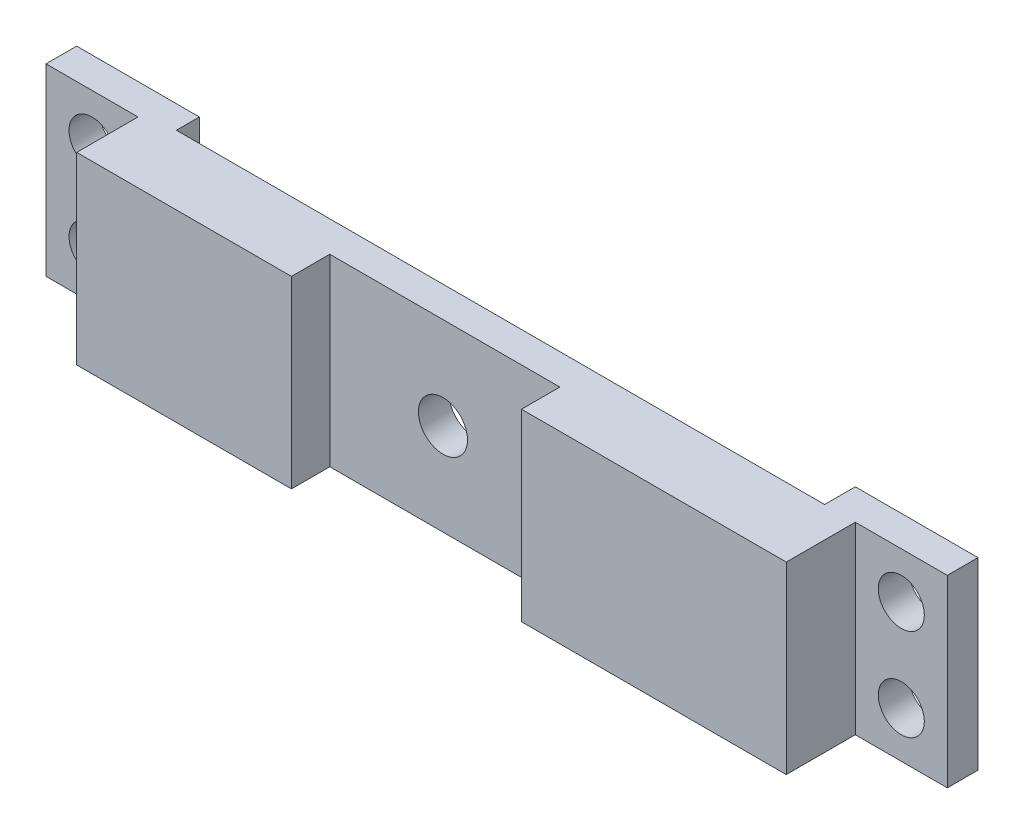
from build123d import *

# Parameters (mm, degrees)
SKETCH1_W       = 35
SKETCH1_H       = 12
EXTRUDE1_DEPTH  = 6
SKETCH2_W       = 6
SKETCH2_H       = 12
EXTRUDE2_DEPTH  = 4
SKETCH3_R       = 1.5
EXTRUDE3_DEPTH  = 2
SKETCH4_R       = 1.6
EXTRUDE4_DEPTH  = 6
SKETCH7_W       = 15
SKETCH7_H       = 12
EXTRUDE6_DEPTH  = 2.5
SKETCH8_W       = 27
SKETCH8_H       = 12
EXTRUDE7_DEPTH  = 1.5
SKETCH9_W       = 4.5
SKETCH9_H       = 12
EXTRUDE8_DEPTH  = 17.26
SKETCH10_W      = 8
SKETCH10_H      = 2
EXTRUDE9_DEPTH  = 12
SKETCH12_R      = 1.5
EXTRUDE10_DEPTH = 2


with BuildPart() as part:
    # Sketch1 → Extrude1 (new body)
    with BuildSketch(Plane.XY):
        Rectangle(SKETCH1_W, SKETCH1_H)
    extrude(amount=EXTRUDE1_DEPTH)

    # Sketch2 → Extrude2 (cut)
    with BuildSketch(Plane.XY.offset(6)):
        with Locations((-14.5, 0)):
            Rectangle(SKETCH2_W, SKETCH2_H)
    extrude(amount=-EXTRUDE2_DEPTH, mode=Mode.SUBTRACT)

    # Sketch3 → Extrude3 (cut)
    with BuildSketch(Plane.XY.offset(2)):
        with Locations((-14.5, 3)):
            Circle(SKETCH3_R)
        with Locations((-14.5, -3)):
            Circle(SKETCH3_R)
    extrude(amount=-EXTRUDE3_DEPTH, mode=Mode.SUBTRACT)

    # Sketch4 → Extrude4 (cut)
    with BuildSketch(Plane.XY.offset(6)):
        with Locations((9.88, 0)):
            Circle(SKETCH4_R)
    extrude(amount=-EXTRUDE4_DEPTH, mode=Mode.SUBTRACT)

    # Sketch7 → Extrude6 (cut)
    with BuildSketch(Plane.XY.offset(6)):
        with Locations((10, 0)):
            Rectangle(SKETCH7_W, SKETCH7_H)
    extrude(amount=-EXTRUDE6_DEPTH, mode=Mode.SUBTRACT)

    # Sketch8 → Extrude7 (cut)
    with BuildSketch(Plane(origin=(0, 0, 0), x_dir=(-1, 0, 0), z_dir=(0, 0, -1))):
        with Locations((-4, 0)):
            Rectangle(SKETCH8_W, SKETCH8_H)
    extrude(amount=-EXTRUDE7_DEPTH, mode=Mode.SUBTRACT)

    # Sketch9 → Extrude8 (add)
    with BuildSketch(Plane(origin=(17.5, 0, 0), x_dir=(0, 0, -1), z_dir=(1, 0, 0))):
        with Locations((-3.75, 0)):
            Rectangle(SKETCH9_W, SKETCH9_H)
    extrude(amount=EXTRUDE8_DEPTH)

    # Sketch10 → Extrude9 (add)
    with BuildSketch(Plane(origin=(0, 6, 0), x_dir=(1, 0, 0), z_dir=(0, 1, 0))):
        with Locations((36.76, -0.5)):
            Rectangle(SKETCH10_W, SKETCH10_H)
    extrude(amount=-EXTRUDE9_DEPTH)

    # Sketch12 → Extrude10 (cut)
    with BuildSketch(Plane.XY.offset(1.5)):
        with Locations((37.76, 3)):
            Circle(SKETCH12_R)
        with Locations((37.76, -3)):
            Circle(SKETCH12_R)
    extrude(amount=-EXTRUDE10_DEPTH, mode=Mode.SUBTRACT)


solid = part.part
